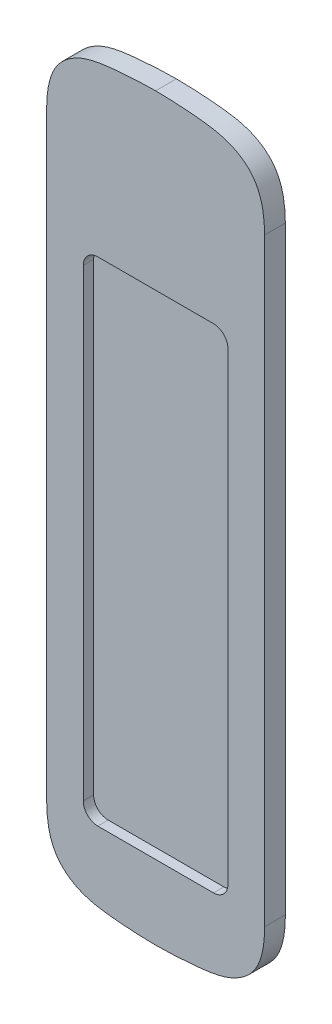
from build123d import *

# Parameters (mm, degrees)
EXTRUDE_1_DEPTH     = 1
SKETCH_6_W          = 6.979999977
SKETCH_6_H          = 23.78
CUT_EXTRUDE_1_DEPTH = 0.5
FILLET_1_R          = 0.7


with BuildPart() as part:
    # 草图1 → 凸台-拉伸1 (new body)
    with BuildSketch(Plane.XY):
        with BuildLine():
            Line((-5.268787068, -23.395653078), (-5.268787078, -52.29634699))
            add(Edge.make_bspline(
                [(-5.268787078, -52.29634699), (-5.268787078, -52.990318083), (-5.137001379, -54.080149918), (-4.182317261, -55.003717165), (-3.39928825, -55.373199943), (-2.383654985, -55.567305407), (-1.243870186, -55.650276692), (-0.457601939, -55.692931511), (-0.012274069, -55.692882673)],
                knots=[0, 0, 0, 0, 0.301160008, 0.404454001, 0.537204471, 0.652206641, 0.831341381, 1, 1, 1, 1], degree=3))
            add(Edge.make_bspline(
                [(-0.012274069, -55.692882673), (0.433053802, -55.692931511), (1.219322049, -55.650276693), (2.359106848, -55.567305408), (3.374740114, -55.373199945), (4.157769124, -55.003717168), (5.112453243, -54.080149921), (5.244238943, -52.990318087), (5.244238943, -52.296346994)],
                knots=[0, 0, 0, 0, 0.168658619, 0.347793359, 0.462795529, 0.595545999, 0.698839992, 1, 1, 1, 1], degree=3))
            Line((5.244238943, -52.296346994), (5.244238953, -23.395653081))
            add(Edge.make_bspline(
                [(5.244238953, -23.395653081), (5.244238953, -22.701681988), (5.112453254, -21.611850154), (4.157769136, -20.688282907), (3.374740126, -20.318800129), (2.359106861, -20.124694665), (1.219322061, -20.041723379), (0.433053814, -19.999068561), (-0.012274056, -19.999117399)],
                knots=[0, 0, 0, 0, 0.301160008, 0.404454001, 0.537204471, 0.652206641, 0.831341381, 1, 1, 1, 1], degree=3))
            add(Edge.make_bspline(
                [(-0.012274056, -19.999117399), (-0.457601926, -19.999068561), (-1.243870174, -20.041723378), (-2.383654973, -20.124694663), (-3.399288238, -20.318800126), (-4.182317249, -20.688282904), (-5.137001368, -21.61185015), (-5.268787067, -22.701681985), (-5.268787068, -23.395653078)],
                knots=[0, 0, 0, 0, 0.168658619, 0.347793359, 0.462795529, 0.595545999, 0.698839992, 1, 1, 1, 1], degree=3))
        make_face()
    extrude(amount=EXTRUDE_1_DEPTH)

    # 草图6 → 切除-拉伸1 (cut)
    with BuildSketch(Plane.XY.offset(1)):
        with Locations((-0.012274056, -40.222000037)):
            Rectangle(SKETCH_6_W, SKETCH_6_H)
    extrude(amount=-CUT_EXTRUDE_1_DEPTH, mode=Mode.SUBTRACT)

    # 圆角1
    fillet_1_edges = [part.edges().sort_by_distance(p)[0] for p in [
        (3.477725932, -52.112000037, 0.75),
        (-3.502274045, -52.112000037, 0.75),
        (-3.502274045, -28.332000037, 0.75),
        (3.477725932, -28.332000037, 0.75),
    ]]
    fillet(fillet_1_edges, radius=FILLET_1_R)


solid = part.part
